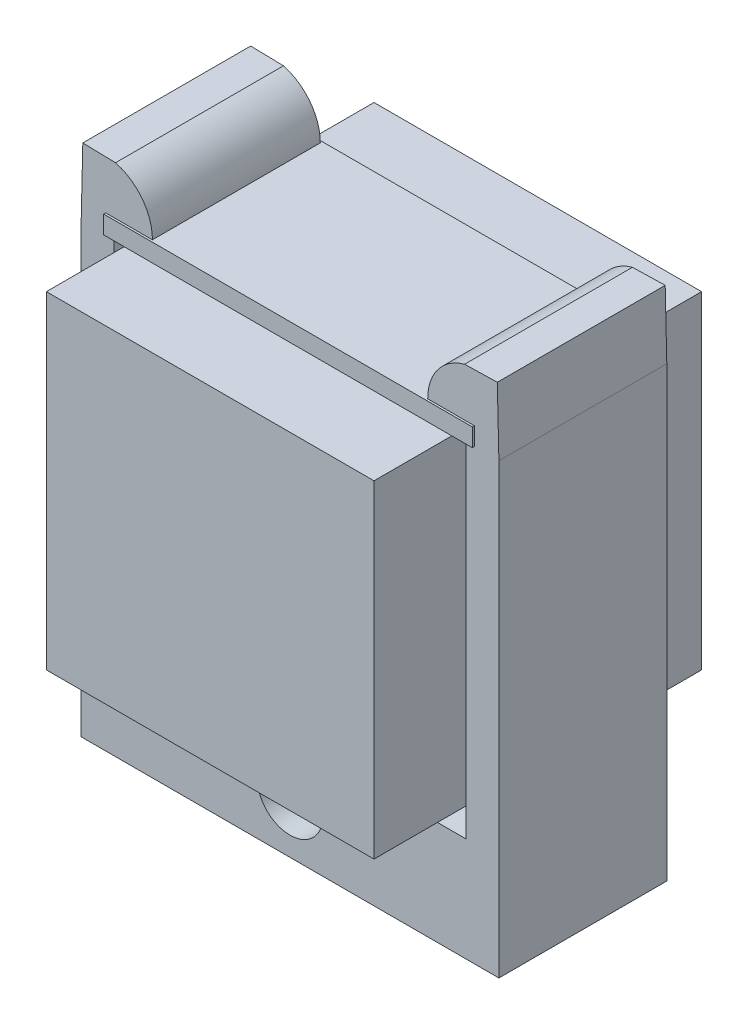
from build123d import *

# Parameters (mm, degrees)
SKETCH1_W                            = 45
SKETCH1_H                            = 21
BOSS_EXTRUDE1_DEPTH                  = 2.2
SKETCH2_W                            = 40
SKETCH2_H                            = 40
BOSS_EXTRUDE2_DEPTH                  = 40
SKETCH3_W                            = 43
SKETCH3_H                            = 12.7
SKETCH3_R                            = 4
SNAPFIT_43MM_SPACING_4MM_WIDTH_DEPTH = 10.25


with BuildPart() as part:
    # Sketch1 → Boss-Extrude1 (new body)
    with BuildSketch(Plane(origin=(0, 0, 0), x_dir=(1, 0, 0), z_dir=(0, 1, 0))):
        Rectangle(SKETCH1_W, SKETCH1_H)
    extrude(amount=BOSS_EXTRUDE1_DEPTH)


with BuildPart() as body_2:
    # Sketch2 → Boss-Extrude2 (new body)
    with BuildSketch(Plane(origin=(0, 0, 0), x_dir=(1, 0, 0), z_dir=(0, 1, 0))):
        Rectangle(SKETCH2_W, SKETCH2_H)
    extrude(amount=-BOSS_EXTRUDE2_DEPTH)


with BuildPart() as body_3:
    # Sketch3 → SnapFit-43mm_spacing-4mm_width (new, symmetric)
    # profile 1 of 3: a face of its own
    with BuildSketch(Plane.XY):
        with Locations((0, -48.35)):
            Rectangle(SKETCH3_W, SKETCH3_H)
        with Locations((0, -48.35)):
            Circle(SKETCH3_R, mode=Mode.SUBTRACT)
    # profile 2 of 3: a face of its own
    with BuildSketch(Plane.XY):
        with BuildLine():
            Line((-25.5, -54.7), (-21.5, -54.7))
            Line((-21.5, -54.7), (-21.5, -42))
            Line((-21.5, -42), (-21.5, 0))
            Line((-21.5, 0), (-21.447633889, 2.199376682))
            Line((-21.447633889, 2.199376682), (-16.805950526, 2.088860412))
            ThreePointArc((-16.805950526, 2.088860412), (-18.015587607, 5.874169911), (-21.305950526, 8.102465613))
            Line((-21.305950526, 8.102465613), (-25.304817221, 8.197676725))
            Line((-25.304817221, 8.197676725), (-25.5, 0))
            Line((-25.5, 0), (-25.5, -54.7))
        make_face()
    # profile 3 of 3: a face of its own
    with BuildSketch(Plane.XY):
        with BuildLine():
            Line((21.5, -42), (21.5, -54.7))
            Line((21.5, -54.7), (25.5, -54.7))
            Line((25.5, -54.7), (25.5, 0))
            Line((25.5, 0), (25.304817221, 8.197676725))
            Line((25.304817221, 8.197676725), (21.305950526, 8.102465613))
            ThreePointArc((21.305950526, 8.102465613), (18.015587607, 5.874169911), (16.805950526, 2.088860412))
            Line((16.805950526, 2.088860412), (21.447633889, 2.199376682))
            Line((21.447633889, 2.199376682), (21.5, 0))
            Line((21.5, 0), (21.5, -42))
        make_face()
    extrude(amount=SNAPFIT_43MM_SPACING_4MM_WIDTH_DEPTH, both=True)


solid = Compound([part.part, body_2.part, body_3.part])
